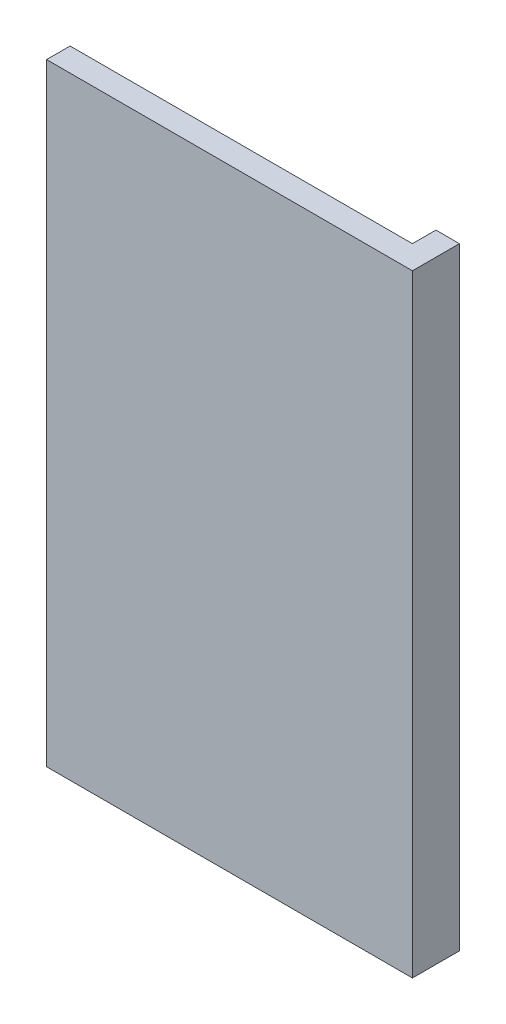
from build123d import *

# Parameters (mm, degrees)
SKETCH2_W           = 31.15
SKETCH2_H           = 52.15
BOSS_EXTRUDE1_DEPTH = 2
BOSS_EXTRUDE2_DEPTH = 2


with BuildPart() as part:
    # Sketch2 → Boss-Extrude1 (new body)
    with BuildSketch(Plane.XY):
        with Locations((1.956924198, 21.925)):
            Rectangle(SKETCH2_W, SKETCH2_H)
    extrude(amount=BOSS_EXTRUDE1_DEPTH)

    # Sketch2<4> → Boss-Extrude2 (add)
    with BuildSketch(Plane.XY):
        Polygon((17.531924198, 48), (15.531924198, 48), (15.531924198, -2.15), (-13.618075802, -2.15), (-13.618075802, -4.15), (17.531924198, -4.15), align=None)
    extrude(amount=-BOSS_EXTRUDE2_DEPTH)


solid = part.part
